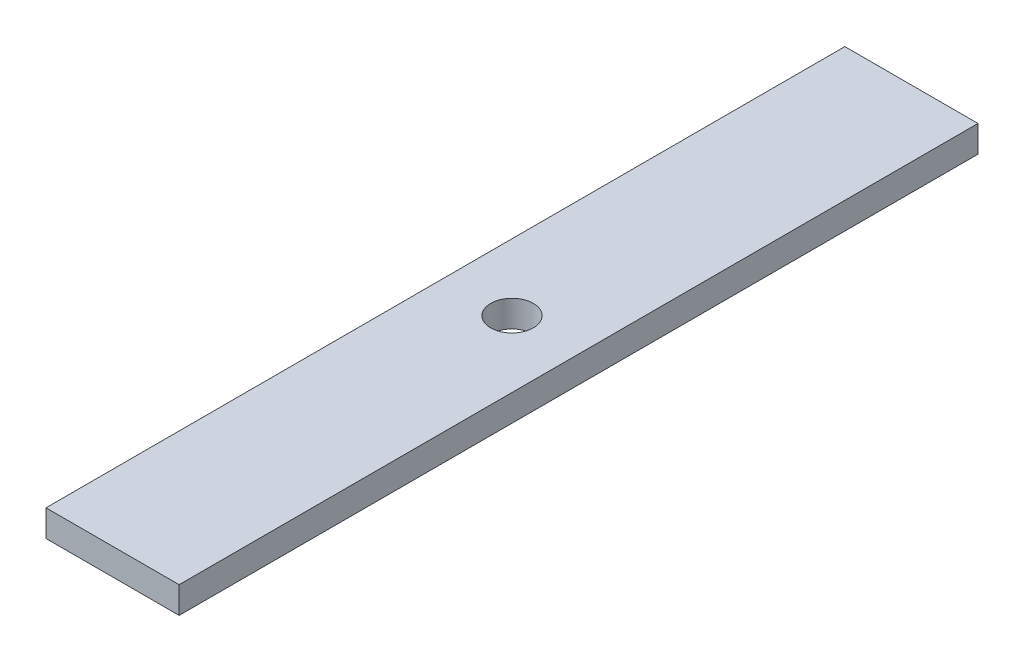
from build123d import *

# Parameters (mm, degrees)
SKETCH1_W                       = 25
SKETCH1_H                       = 5
BOSS_EXTRUDE1_DEPTH             = 106
SKETCH2_R                       = 4
HOLES_FOR_20MM_STRIP_ONLY_DEPTH = 107.851532511
SKETCH5_OUTSIDE_W               = 69.706
SKETCH5_OUTSIDE_H               = 256.706
SKETCH5_OUTSIDE_W_2             = 51.505008444
SKETCH5_OUTSIDE_H_2             = 150
CUT_EXTRUDE3_DEPTH              = 107.851532511


with BuildPart() as part:
    # Sketch1 → Boss-Extrude1 (new, symmetric)
    with BuildSketch(Plane.XY):
        Rectangle(SKETCH1_W, SKETCH1_H)
    extrude(amount=BOSS_EXTRUDE1_DEPTH, both=True)

    # Sketch2 → Holes for 20mm strip ONLY (cut, through all)
    with BuildSketch(Plane(origin=(0, 2.5, 0), x_dir=(1, 0, 0), z_dir=(0, 1, 0))):
        with Locations(Location((0, 87.5, 0), (0, 0, 180))):
            Circle(SKETCH2_R)
        with Locations(Location((0, 0, 0), (0, 0, 180))):
            Circle(SKETCH2_R)
        with Locations(Location((0, -87.5, 0), (0, 0, 180))):
            Circle(SKETCH2_R)
    extrude(amount=-HOLES_FOR_20MM_STRIP_ONLY_DEPTH, mode=Mode.SUBTRACT)

    # Sketch5 outside → Cut-Extrude3 (cut, through all)
    with BuildSketch(Plane(origin=(0, 2.5, 0), x_dir=(1, 0, 0), z_dir=(0, 1, 0))):
        Rectangle(SKETCH5_OUTSIDE_W, SKETCH5_OUTSIDE_H)
        Rectangle(SKETCH5_OUTSIDE_W_2, SKETCH5_OUTSIDE_H_2, mode=Mode.SUBTRACT)
    extrude(amount=-CUT_EXTRUDE3_DEPTH, mode=Mode.SUBTRACT)


solid = part.part
